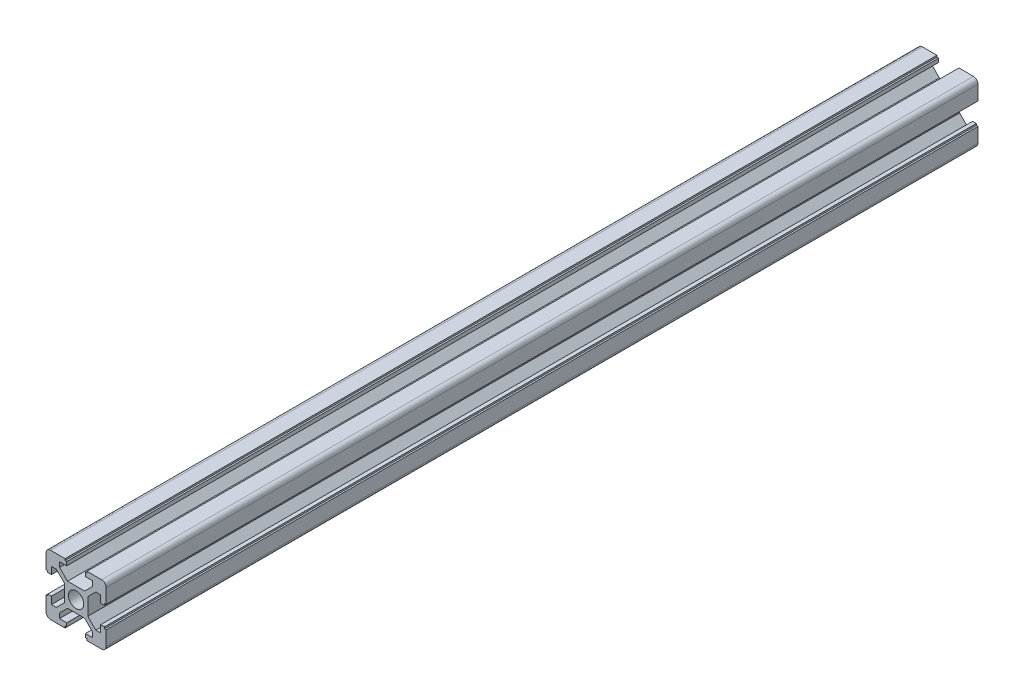
from build123d import *

# Parameters (mm, degrees)
BOSS_EXTRUDE1_DEPTH = 290
SKETCH3_R           = 2.55
CUT_EXTRUDE1_DEPTH  = 291.344622819
FILLET1_R           = 1.5


with BuildPart() as part:
    # Sketch2 → Boss-Extrude1 (new body)
    with BuildSketch(Plane.XY):
        Polygon((-10, 10), (-3.65, 10), (-3.65, 9.45), (-3.1, 9.45), (-3.1, 8.2), (-5.5, 8.2), (-5.5, 6.560660172), (-2.839339828, 3.9), (0, 3.9), (2.839339828, 3.9), (5.5, 6.560660172), (5.5, 8.2), (3.1, 8.2), (3.1, 9.45), (3.65, 9.45), (3.65, 10), (10, 10), (10, 3.65), (9.45, 3.65), (9.45, 3.1), (8.2, 3.1), (8.2, 5.5), (6.560660172, 5.5), (3.9, 2.839339828), (3.9, 0), (3.9, -2.839339828), (6.560660172, -5.5), (8.2, -5.5), (8.2, -3.1), (9.45, -3.1), (9.45, -3.65), (10, -3.65), (10, -10), (3.65, -10), (3.65, -9.45), (3.1, -9.45), (3.1, -8.2), (5.5, -8.2), (5.5, -6.560660172), (2.839339828, -3.9), (0, -3.9), (-2.839339828, -3.9), (-5.5, -6.560660172), (-5.5, -8.2), (-3.1, -8.2), (-3.1, -9.45), (-3.65, -9.45), (-3.65, -10), (-10, -10), (-10, -3.65), (-9.45, -3.65), (-9.45, -3.1), (-8.2, -3.1), (-8.2, -5.5), (-6.560660172, -5.5), (-3.9, -2.839339828), (-3.9, 0), (-3.9, 2.839339828), (-6.560660172, 5.5), (-8.2, 5.5), (-8.2, 3.1), (-9.45, 3.1), (-9.45, 3.65), (-10, 3.65), align=None)
    extrude(amount=-BOSS_EXTRUDE1_DEPTH)

    # Sketch3 → Cut-Extrude1 (cut, through all)
    with BuildSketch(Plane.XY):
        Circle(SKETCH3_R)
    extrude(amount=-CUT_EXTRUDE1_DEPTH, mode=Mode.SUBTRACT)

    # Fillet1
    fillet1_edges = [part.edges().sort_by_distance(p)[0] for p in [
        (10, 10, -145),
        (10, -10, -145),
        (-10, -10, -145),
        (-10, 10, -145),
    ]]
    fillet(fillet1_edges, radius=FILLET1_R)


solid = part.part
